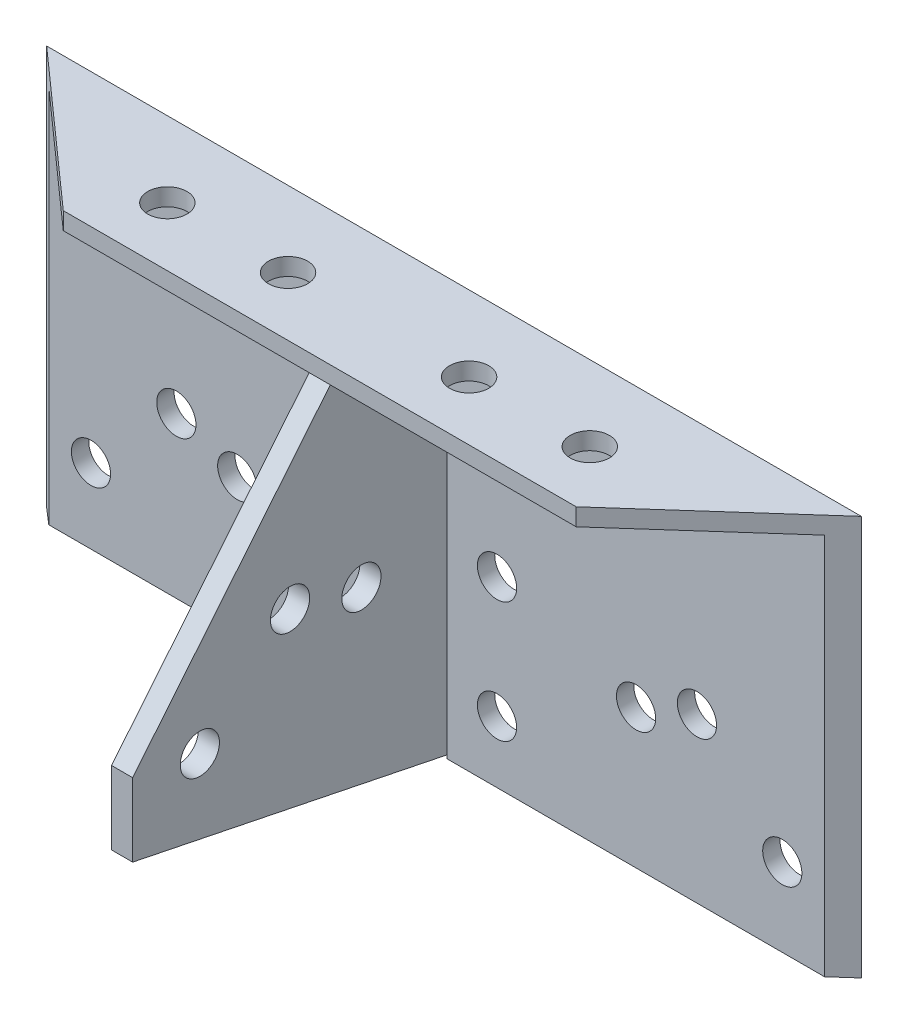
from build123d import *

# Parameters (mm, degrees)
SKETCH_1_W          = 540
SKETCH_1_H          = 265
SKETCH_1_R          = 13
EXTRUDE_551_DEPTH   = 11.5
SKETCH_2_W          = 540
SKETCH_2_H          = 11.5
EXTRUDE_1_DEPTH     = 77.5
CUT_EXTRUDE_1_DEPTH = 609.067430471
SKETCH_4_R          = 13
CUT_EXTRUDE_2_DEPTH = 609.067430471
SKETCH_5_W          = 14
SKETCH_5_H          = 253.5
EXTRUDE_2_DEPTH     = 208.5
SKETCH_6_R          = 13
CUT_EXTRUDE_3_DEPTH = 442.988687638


with BuildPart() as part:
    # 草图1 → Extrude 551 (new body)
    with BuildSketch(Plane.XY):
        with Locations((270, 132.5)):
            Rectangle(SKETCH_1_W, SKETCH_1_H)
        with Locations((97.46594539, 108.46594539)):
            Circle(SKETCH_1_R, mode=Mode.SUBTRACT)
        with Locations((40.897402896, 51.897402896)):
            Circle(SKETCH_1_R, mode=Mode.SUBTRACT)
        with Locations(Location((499.102597104, 51.897402896, 0), (0, 0, 180))):
            Circle(SKETCH_1_R, mode=Mode.SUBTRACT)
        with Locations(Location((402.170987639, 92.261534081, 0), (0, 0, 180))):
            Circle(SKETCH_1_R, mode=Mode.SUBTRACT)
        with Locations((230, 121)):
            Circle(SKETCH_1_R, mode=Mode.SUBTRACT)
        with Locations((230, 41)):
            Circle(SKETCH_1_R, mode=Mode.SUBTRACT)
        with Locations(Location((310, 41, 0), (0, 0, 180))):
            Circle(SKETCH_1_R, mode=Mode.SUBTRACT)
        with Locations(Location((310, 121, 0), (0, 0, 180))):
            Circle(SKETCH_1_R, mode=Mode.SUBTRACT)
        with Locations((137.829012361, 92.261534081)):
            Circle(SKETCH_1_R, mode=Mode.SUBTRACT)
        with Locations(Location((442.53405461, 108.46594539, 0), (0, 0, 180))):
            Circle(SKETCH_1_R, mode=Mode.SUBTRACT)
    extrude(amount=EXTRUDE_551_DEPTH)

    # 草图2 → 凸台-拉伸1 (add)
    with BuildSketch(Plane.XY.offset(11.5)):
        with Locations((270, 259.25)):
            Rectangle(SKETCH_2_W, SKETCH_2_H)
    extrude(amount=EXTRUDE_1_DEPTH)

    # 草图3 → 切除-拉伸1 (cut, through all)
    with BuildSketch(Plane(origin=(0, 265, 0), x_dir=(-1, 0, 0), z_dir=(0, 1, 0))):
        Polygon((0, 0), (-100, 89), (0, 89), align=None)
        Polygon((-540, 0), (-440, 89), (-540, 89), align=None)
    extrude(amount=-CUT_EXTRUDE_1_DEPTH, mode=Mode.SUBTRACT)

    # 草图4 → 切除-拉伸2 (cut, through all)
    with BuildSketch(Plane(origin=(0, 265, 0), x_dir=(-1, 0, 0), z_dir=(0, 1, 0))):
        with Locations(Location((-210, 50, 0), (0, 0, 90))):
            Circle(SKETCH_4_R)
        with Locations(Location((-130, 50, 0), (0, 0, 90))):
            Circle(SKETCH_4_R)
        with Locations(Location((-410, 50, 0), (0, 0, 90))):
            Circle(SKETCH_4_R)
        with Locations(Location((-330, 50, 0), (0, 0, 90))):
            Circle(SKETCH_4_R)
    extrude(amount=-CUT_EXTRUDE_2_DEPTH, mode=Mode.SUBTRACT)

    # 草图5 → 凸台-拉伸2 (add)
    with BuildSketch(Plane.XY.offset(11.5)):
        with Locations((270, 126.75)):
            Rectangle(SKETCH_5_W, SKETCH_5_H)
    extrude(amount=EXTRUDE_2_DEPTH)

    # 草图6 → 切除-拉伸3 (cut, through all)
    with BuildSketch(Plane(origin=(277, 0, 0), x_dir=(0, 0, -1), z_dir=(1, 0, 0))):
        with Locations((-115.676148082, 138.142814541)):
            Circle(SKETCH_6_R)
        with Locations((-175.462621788, 84.986652509)):
            Circle(SKETCH_6_R)
        with Locations((-68.377294113, 126.911974174)):
            Circle(SKETCH_6_R)
        Polygon((-89, 253.5), (-220, 93.5), (-220, 253.5), align=None)
        Polygon((-220, 45), (0, 0), (-220, 0), align=None)
    extrude(amount=-CUT_EXTRUDE_3_DEPTH, mode=Mode.SUBTRACT)


solid = part.part
